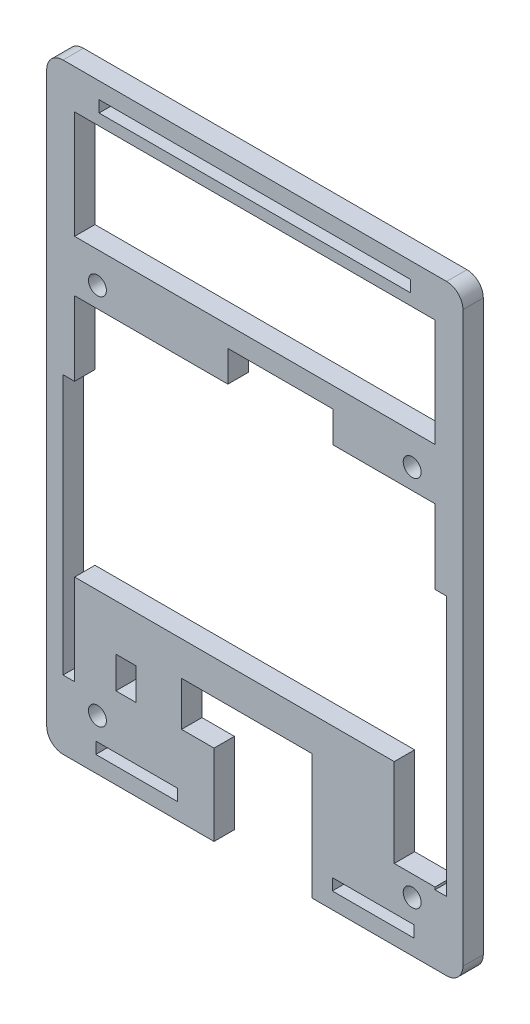
from build123d import *

# Parameters (mm, degrees)
SKETCH1_R           = 1.397
SKETCH1_W           = 12.7
SKETCH1_H           = 1.8034
SKETCH1_W_2         = 3.175
SKETCH1_H_2         = 4.953
SKETCH1_W_3         = 56.134
SKETCH1_H_3         = 16.7894
SKETCH1_W_4         = 48.514
BOSS_EXTRUDE1_DEPTH = 3.175


with BuildPart() as part:
    # Sketch1 → Boss-Extrude1 (new body)
    with BuildSketch(Plane.XY):
        with BuildLine():
            Line((36.9824, 15.1384), (36.9824, -4.3434))
            Line((36.9824, -4.3434), (57.9374, -4.3434))
            ThreePointArc((57.9374, -4.3434), (59.733451224, -3.599451224), (60.4774, -1.8034))
            Line((60.4774, -1.8034), (60.4774, 86.7664))
            ThreePointArc((60.4774, 86.7664), (59.733451224, 88.562451224), (57.9374, 89.3064))
            Line((57.9374, 89.3064), (-1.8034, 89.3064))
            ThreePointArc((-1.8034, 89.3064), (-3.599451224, 88.562451224), (-4.3434, 86.7664))
            Line((-4.3434, 86.7664), (-4.3434, -1.8034))
            ThreePointArc((-4.3434, -1.8034), (-3.599451224, -3.599451224), (-1.8034, -4.3434))
            Line((-1.8034, -4.3434), (21.717, -4.3434))
            Line((21.717, -4.3434), (21.717, 8.255))
            Line((21.717, 8.255), (16.6624, 8.255))
            Line((16.6624, 8.255), (16.6624, 15.1384))
            Line((16.6624, 15.1384), (36.9824, 15.1384))
        make_face()
        with Locations((3.556, 3.556)):
            Circle(SKETCH1_R, mode=Mode.SUBTRACT)
        with Locations((9.652, -0.9017)):
            Rectangle(SKETCH1_W, SKETCH1_H, mode=Mode.SUBTRACT)
        with Locations((8.0137, 10.8077)):
            Rectangle(SKETCH1_W_2, SKETCH1_H_2, mode=Mode.SUBTRACT)
        with Locations((46.482, -0.9017)):
            Rectangle(SKETCH1_W, SKETCH1_H, mode=Mode.SUBTRACT)
        with Locations((52.578, 3.556)):
            Circle(SKETCH1_R, mode=Mode.SUBTRACT)
        Polygon((49.784, 20.4724), (0, 20.4724), (0, 6.35), (-1.8034, 6.35), (-1.8034, 46.863), (0, 46.863), (0, 58.42), (23.876, 58.42), (23.876, 63.246), (40.259, 63.246), (40.259, 58.42), (56.134, 58.42), (56.134, 46.863), (57.9374, 46.863), (57.9374, 6.35), (56.134, 6.35), (56.134, 6.731), (49.784, 6.731), align=None, mode=Mode.SUBTRACT)
        with Locations((28.067, 74.8157)):
            Rectangle(SKETCH1_W_3, SKETCH1_H_3, mode=Mode.SUBTRACT)
        with Locations((28.067, 85.8647)):
            Rectangle(SKETCH1_W_4, SKETCH1_H, mode=Mode.SUBTRACT)
        with Locations((3.556, 61.595)):
            Circle(SKETCH1_R, mode=Mode.SUBTRACT)
        with Locations((52.578, 61.595)):
            Circle(SKETCH1_R, mode=Mode.SUBTRACT)
    extrude(amount=BOSS_EXTRUDE1_DEPTH)


solid = part.part
